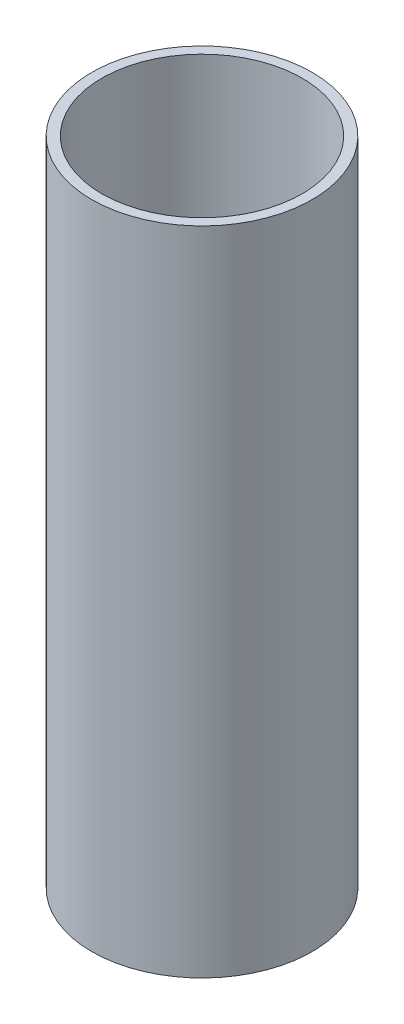
from build123d import *

# Parameters (mm, degrees)
SKETCH_2_R          = 11
EXTRUDE_5_DEPTH     = 65
SKETCH_3_R          = 10
CUT_EXTRUDE_1_DEPTH = 64


with BuildPart() as part:
    # ｽｹｯﾁ2 → ﾎﾞｽ - 押し出し5 (new body)
    with BuildSketch(Plane(origin=(0, 0, 0), x_dir=(1, 0, 0), z_dir=(0, 1, 0))):
        with Locations(Location((0, 0, 0), (0, 0, 270))):
            Circle(SKETCH_2_R)
    extrude(amount=EXTRUDE_5_DEPTH)

    # ｽｹｯﾁ3 → ｶｯﾄ - 押し出し1 (cut)
    with BuildSketch(Plane(origin=(0, 65, 0), x_dir=(1, 0, 0), z_dir=(0, 1, 0))):
        with Locations(Location((0, 0, 0), (0, 0, 270))):
            Circle(SKETCH_3_R)
    extrude(amount=-CUT_EXTRUDE_1_DEPTH, mode=Mode.SUBTRACT)


solid = part.part
